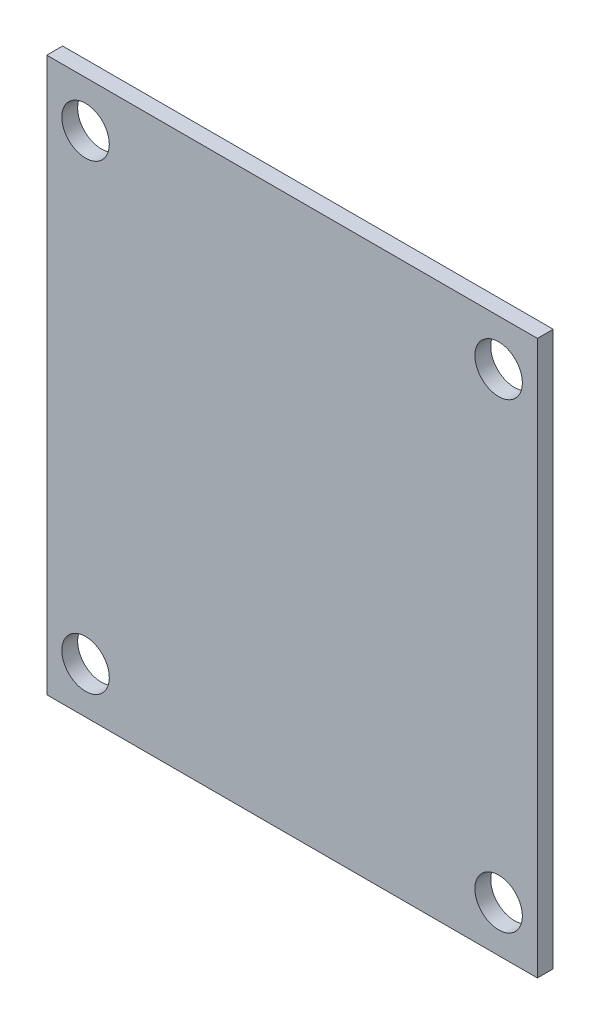
from build123d import *

# Parameters (mm, degrees)
SKETCH1_W           = 31
SKETCH1_H           = 35
SKETCH1_R           = 1.5
BOSS_EXTRUDE1_DEPTH = 1


with BuildPart() as part:
    # Sketch1 → Boss-Extrude1 (new body)
    with BuildSketch(Plane.XY):
        with Locations((57.870079041, 48.516990662)):
            Rectangle(SKETCH1_W, SKETCH1_H)
        with Locations((44.820079041, 63.106990662)):
            Circle(SKETCH1_R, mode=Mode.SUBTRACT)
        with Locations((70.920079041, 63.106990662)):
            Circle(SKETCH1_R, mode=Mode.SUBTRACT)
        with Locations((44.820079041, 33.926990662)):
            Circle(SKETCH1_R, mode=Mode.SUBTRACT)
        with Locations((70.920079041, 33.926990662)):
            Circle(SKETCH1_R, mode=Mode.SUBTRACT)
    extrude(amount=BOSS_EXTRUDE1_DEPTH)


solid = part.part
